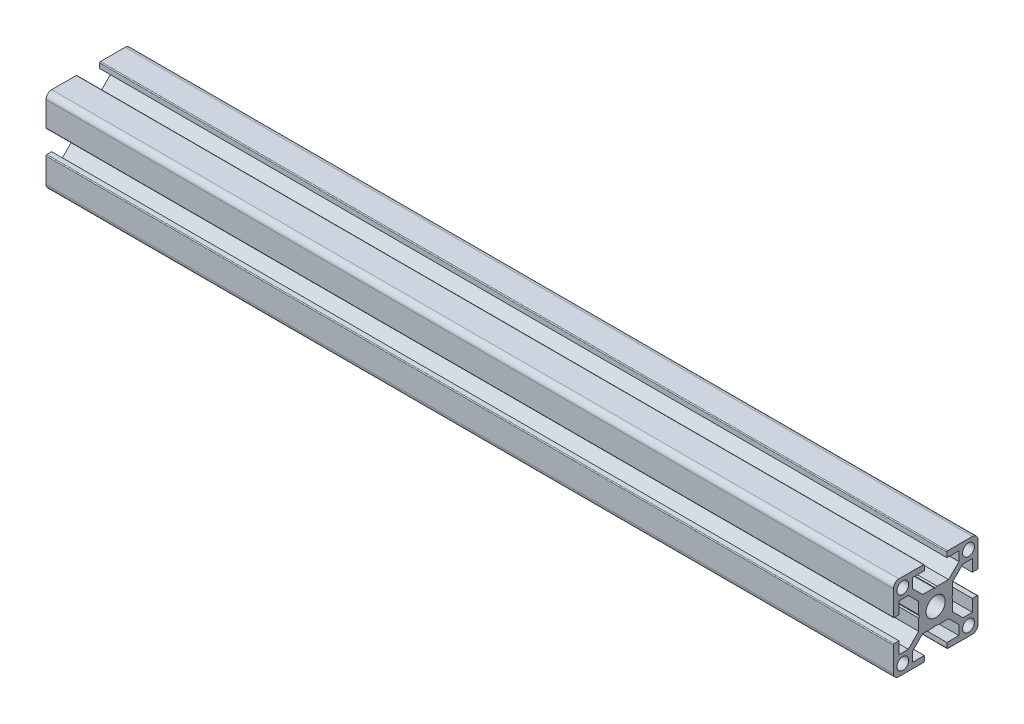
from build123d import *

# Parameters (mm, degrees)
SKETCH_1_R              = 2.1
SKETCH_1_R_2            = 3.4
F_30XS6_30X30S6_1_DEPTH = 300


with BuildPart() as part:
    # 草图1 → 30xs6 30X30S6(1) (new body)
    with BuildSketch(Plane.YZ):
        with BuildLine():
            Line((-14.7, 4), (-13, 4))
            Line((-13, 4), (-13, 8.25))
            Line((-13, 8.25), (-9.664213562, 8.25))
            Line((-9.664213562, 8.25), (-6, 4.585786438))
            Line((-6, 4.585786438), (-6, 0.519615242))
            Line((-6, 0.519615242), (-5.7, 0))
            Line((-5.7, 0), (-6, -0.519615242))
            Line((-6, -0.519615242), (-6, -4.585786438))
            Line((-6, -4.585786438), (-9.664213562, -8.25))
            Line((-9.664213562, -8.25), (-13, -8.25))
            Line((-13, -8.25), (-13, -4))
            Line((-13, -4), (-14.7, -4))
            ThreePointArc((-14.7, -4), (-14.912132034, -4.087867966), (-15, -4.3))
            Line((-15, -4.3), (-15, -13))
            ThreePointArc((-15, -13), (-14.414213562, -14.414213562), (-13, -15))
            Line((-13, -15), (-4.3, -15))
            ThreePointArc((-4.3, -15), (-4.087867966, -14.912132034), (-4, -14.7))
            Line((-4, -14.7), (-4, -13))
            Line((-4, -13), (-8.25, -13))
            Line((-8.25, -13), (-8.25, -9.664213562))
            Line((-8.25, -9.664213562), (-4.585786438, -6))
            Line((-4.585786438, -6), (-0.519615242, -6))
            Line((-0.519615242, -6), (0, -5.7))
            Line((0, -5.7), (0.519615242, -6))
            Line((0.519615242, -6), (4.585786438, -6))
            Line((4.585786438, -6), (8.25, -9.664213562))
            Line((8.25, -9.664213562), (8.25, -13))
            Line((8.25, -13), (4, -13))
            Line((4, -13), (4, -14.7))
            ThreePointArc((4, -14.7), (4.087867966, -14.912132034), (4.3, -15))
            Line((4.3, -15), (13, -15))
            ThreePointArc((13, -15), (14.414213562, -14.414213562), (15, -13))
            Line((15, -13), (15, -4.3))
            ThreePointArc((15, -4.3), (14.912132034, -4.087867966), (14.7, -4))
            Line((14.7, -4), (13, -4))
            Line((13, -4), (13, -8.25))
            Line((13, -8.25), (9.664213562, -8.25))
            Line((9.664213562, -8.25), (6, -4.585786438))
            Line((6, -4.585786438), (6, -0.519615242))
            Line((6, -0.519615242), (5.7, 0))
            Line((5.7, 0), (6, 0.519615242))
            Line((6, 0.519615242), (6, 4.585786438))
            Line((6, 4.585786438), (9.664213562, 8.25))
            Line((9.664213562, 8.25), (13, 8.25))
            Line((13, 8.25), (13, 4))
            Line((13, 4), (14.7, 4))
            ThreePointArc((14.7, 4), (14.912132034, 4.087867966), (15, 4.3))
            Line((15, 4.3), (15, 13))
            ThreePointArc((15, 13), (14.414213562, 14.414213562), (13, 15))
            Line((13, 15), (4.3, 15))
            ThreePointArc((4.3, 15), (4.087867966, 14.912132034), (4, 14.7))
            Line((4, 14.7), (4, 13))
            Line((4, 13), (8.25, 13))
            Line((8.25, 13), (8.25, 9.664213562))
            Line((8.25, 9.664213562), (4.585786438, 6))
            Line((4.585786438, 6), (0.519615242, 6))
            Line((0.519615242, 6), (0, 5.7))
            Line((0, 5.7), (-0.519615242, 6))
            Line((-0.519615242, 6), (-4.585786438, 6))
            Line((-4.585786438, 6), (-8.25, 9.664213562))
            Line((-8.25, 9.664213562), (-8.25, 13))
            Line((-8.25, 13), (-4, 13))
            Line((-4, 13), (-4, 14.7))
            ThreePointArc((-4, 14.7), (-4.087867966, 14.912132034), (-4.3, 15))
            Line((-4.3, 15), (-13, 15))
            ThreePointArc((-13, 15), (-14.414213562, 14.414213562), (-15, 13))
            Line((-15, 13), (-15, 4.3))
            ThreePointArc((-15, 4.3), (-14.912132034, 4.087867966), (-14.7, 4))
        make_face()
        with Locations((11.625, 11.625)):
            Circle(SKETCH_1_R, mode=Mode.SUBTRACT)
        with Locations((11.625, -11.625)):
            Circle(SKETCH_1_R, mode=Mode.SUBTRACT)
        Circle(SKETCH_1_R_2, mode=Mode.SUBTRACT)
        with Locations((-11.625, -11.625)):
            Circle(SKETCH_1_R, mode=Mode.SUBTRACT)
        with Locations((-11.625, 11.625)):
            Circle(SKETCH_1_R, mode=Mode.SUBTRACT)
    extrude(amount=F_30XS6_30X30S6_1_DEPTH)


solid = part.part
